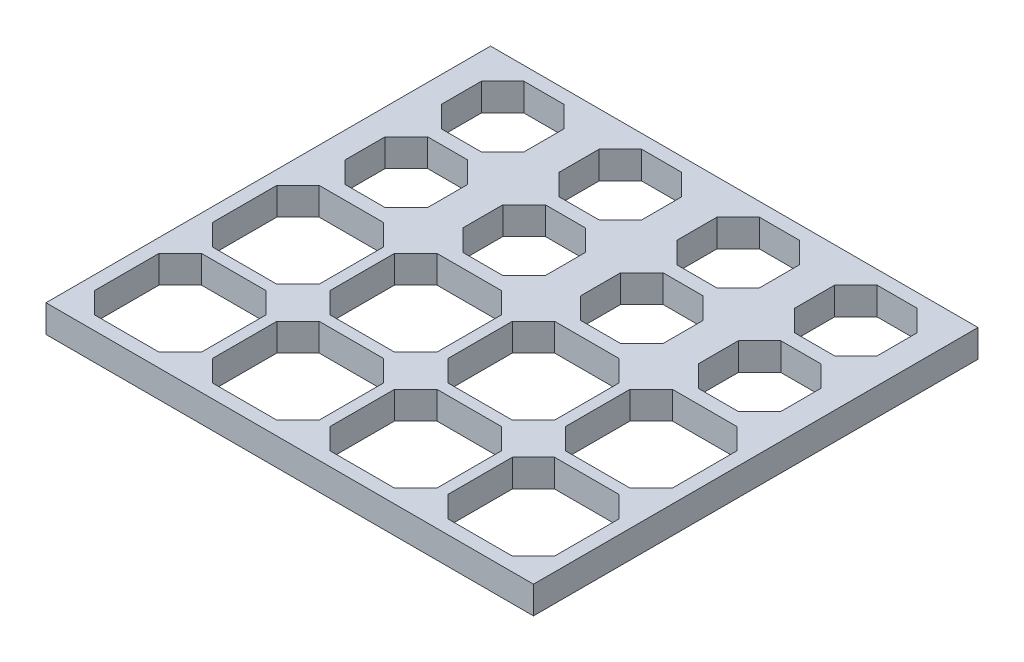
from build123d import *

# Parameters (mm, degrees)
SKETCH1_W           = 177.2
SKETCH1_H           = 161.6
BOSS_EXTRUDE1_DEPTH = 10


with BuildPart() as part:
    # Sketch1 → Boss-Extrude1 (new body)
    with BuildSketch(Plane(origin=(0, 0, 0), x_dir=(1, 0, 0), z_dir=(0, 1, 0))):
        with Locations((88.6, 80.8)):
            Rectangle(SKETCH1_W, SKETCH1_H)
        Polygon((5, 36.112698372), (5, 12.687301628), (12.687301628, 5), (36.112698372, 5), (43.8, 12.687301628), (43.8, 36.112698372), (36.112698372, 43.8), (12.687301628, 43.8), align=None, mode=Mode.SUBTRACT)
        Polygon((55.487301628, 43.8), (47.8, 36.112698372), (47.8, 12.687301628), (55.487301628, 5), (78.912698372, 5), (86.6, 12.687301628), (86.6, 36.112698372), (78.912698372, 43.8), align=None, mode=Mode.SUBTRACT)
        Polygon((98.287301628, 43.8), (90.6, 36.112698372), (90.6, 12.687301628), (98.287301628, 5), (121.712698372, 5), (129.4, 12.687301628), (129.4, 36.112698372), (121.712698372, 43.8), align=None, mode=Mode.SUBTRACT)
        Polygon((141.087301628, 43.8), (133.4, 36.112698372), (133.4, 12.687301628), (141.087301628, 5), (164.512698372, 5), (172.2, 12.687301628), (172.2, 36.112698372), (164.512698372, 43.8), align=None, mode=Mode.SUBTRACT)
        Polygon((55.487301628, 86.6), (47.8, 78.912698372), (47.8, 55.487301628), (55.487301628, 47.8), (78.912698372, 47.8), (86.6, 55.487301628), (86.6, 78.912698372), (78.912698372, 86.6), align=None, mode=Mode.SUBTRACT)
        Polygon((98.287301628, 86.6), (90.6, 78.912698372), (90.6, 55.487301628), (98.287301628, 47.8), (121.712698372, 47.8), (129.4, 55.487301628), (129.4, 78.912698372), (121.712698372, 86.6), align=None, mode=Mode.SUBTRACT)
        Polygon((141.087301628, 86.6), (133.4, 78.912698372), (133.4, 55.487301628), (141.087301628, 47.8), (164.512698372, 47.8), (172.2, 55.487301628), (172.2, 78.912698372), (164.512698372, 86.6), align=None, mode=Mode.SUBTRACT)
        Polygon((12.687301628, 86.6), (5, 78.912698372), (5, 55.487301628), (12.687301628, 47.8), (36.112698372, 47.8), (43.8, 55.487301628), (43.8, 78.912698372), (36.112698372, 86.6), align=None, mode=Mode.SUBTRACT)
        Polygon((9.4, 113.873863607), (9.4, 99.326136393), (17.126136393, 91.6), (31.673863607, 91.6), (39.4, 99.326136393), (39.4, 113.873863607), (31.673863607, 121.6), (17.126136393, 121.6), align=None, mode=Mode.SUBTRACT)
        Polygon((52.2, 113.873863607), (52.2, 99.326136393), (59.926136393, 91.6), (74.473863607, 91.6), (82.2, 99.326136393), (82.2, 113.873863607), (74.473863607, 121.6), (59.926136393, 121.6), align=None, mode=Mode.SUBTRACT)
        Polygon((95, 113.873863607), (95, 99.326136393), (102.726136393, 91.6), (117.273863607, 91.6), (125, 99.326136393), (125, 113.873863607), (117.273863607, 121.6), (102.726136393, 121.6), align=None, mode=Mode.SUBTRACT)
        Polygon((137.8, 113.873863607), (137.8, 99.326136393), (145.526136393, 91.6), (160.073863607, 91.6), (167.8, 99.326136393), (167.8, 113.873863607), (160.073863607, 121.6), (145.526136393, 121.6), align=None, mode=Mode.SUBTRACT)
        Polygon((52.2, 148.873863607), (52.2, 134.326136393), (59.926136393, 126.6), (74.473863607, 126.6), (82.2, 134.326136393), (82.2, 148.873863607), (74.473863607, 156.6), (59.926136393, 156.6), align=None, mode=Mode.SUBTRACT)
        Polygon((95, 148.873863607), (95, 134.326136393), (102.726136393, 126.6), (117.273863607, 126.6), (125, 134.326136393), (125, 148.873863607), (117.273863607, 156.6), (102.726136393, 156.6), align=None, mode=Mode.SUBTRACT)
        Polygon((137.8, 148.873863607), (137.8, 134.326136393), (145.526136393, 126.6), (160.073863607, 126.6), (167.8, 134.326136393), (167.8, 148.873863607), (160.073863607, 156.6), (145.526136393, 156.6), align=None, mode=Mode.SUBTRACT)
        Polygon((9.4, 148.873863607), (9.4, 134.326136393), (17.126136393, 126.6), (31.673863607, 126.6), (39.4, 134.326136393), (39.4, 148.873863607), (31.673863607, 156.6), (17.126136393, 156.6), align=None, mode=Mode.SUBTRACT)
    extrude(amount=BOSS_EXTRUDE1_DEPTH)


solid = part.part
